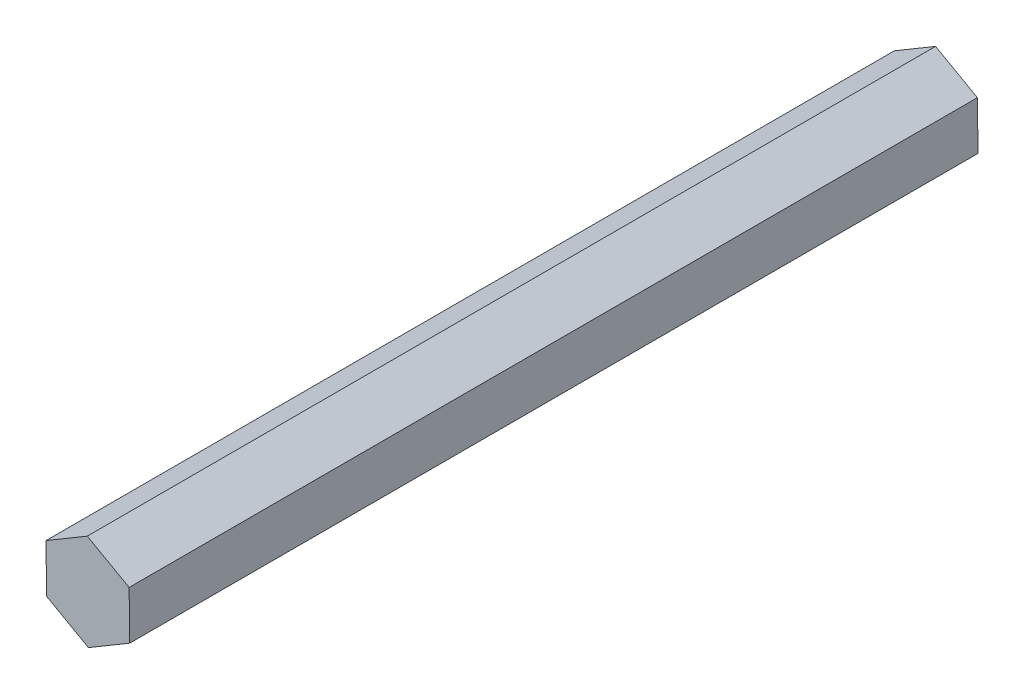
from build123d import *

# Parameters (mm, degrees)
BOSS_EXTRUDE1_DEPTH = 25


with BuildPart() as part:
    # Sketch1 → Boss-Extrude1 (new body)
    with BuildSketch(Plane.XY):
        Polygon((1.216520564, 0.721741678), (-0.016786346, 1.414408552), (-1.23330691, 0.692666874), (-1.216520564, -0.721741678), (0.016786346, -1.414408552), (1.23330691, -0.692666874), align=None)
    extrude(amount=BOSS_EXTRUDE1_DEPTH)


solid = part.part
